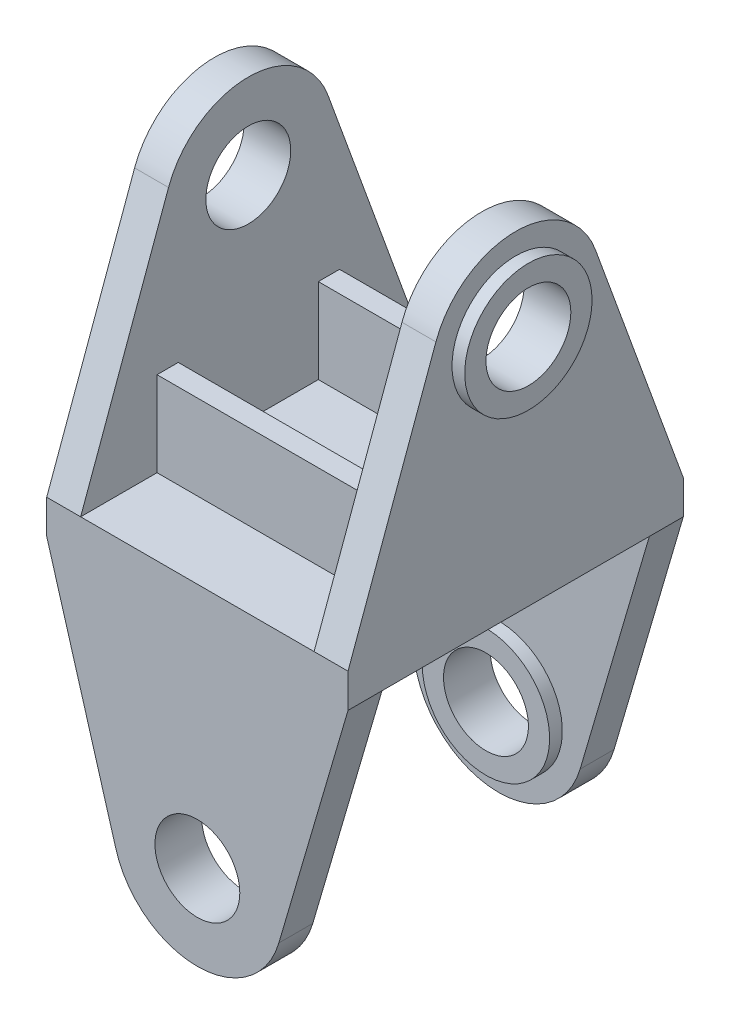
from build123d import *

# Parameters (mm, degrees)
SKETCH1_R                 = 15
BOSS_EXTRUDE1_DEPTH       = 8
BOSS_EXTRUDE2_START       = 3
SKETCH1_3_R               = 15
SKETCH1_3_R_2             = 10
BOSS_EXTRUDE2_DEPTH       = 11
BOSS_EXTRUDE3_START       = -63
SKETCH1_4_R               = 15
BOSS_EXTRUDE3_DEPTH       = 8
LPATTERN3_COUNT           = 2
LPATTERN3_PITCH           = 66
SKETCH3_R                 = 15
BOSS_EXTRUDE7_DEPTH       = 8
SKETCH3_7_R               = 15
SKETCH3_7_R_2             = 10
BOSS_EXTRUDE8_DEPTH       = 11
BOSS_EXTRUDE9_START       = -8
SKETCH4_R                 = 15
BOSS_EXTRUDE9_DEPTH       = 8
BOSS_EXTRUDE10_START      = -11
SKETCH4_4_R               = 15
SKETCH4_4_R_2             = 10
BOSS_EXTRUDE10_DEPTH      = 11
SKETCH5_W                 = 55
SKETCH5_H                 = 18
SKETCH5_H_2               = 33
BOSS_EXTRUDE11_DEPTH      = 8
BOSS_EXTRUDE13_DEPTH      = 20
BOSS_EXTRUDE13_DEPTH_BACK = 8
SKETCH5_3_W               = 55
SKETCH5_3_H               = 5


with BuildPart() as part:
    # Sketch1 → Boss-Extrude1 (new body)
    with BuildSketch(Plane(origin=(0, 0, 0), x_dir=(0, 0, -1), z_dir=(1, 0, 0))):
        with BuildLine():
            Line((-18.791946309, 6.845637584), (-39.5, -50))
            Line((-39.5, -50), (-39.5, -58))
            Line((-39.5, -58), (39.5, -58))
            Line((39.5, -58), (39.5, -50))
            Line((39.5, -50), (18.791946309, 6.845637584))
            ThreePointArc((18.791946309, 6.845637584), (0, 20), (-18.791946309, 6.845637584))
        make_face()
        Circle(SKETCH1_R, mode=Mode.SUBTRACT)
    extrude(amount=-BOSS_EXTRUDE1_DEPTH)

    # Sketch1<3> → Boss-Extrude2 (add)
    with BuildSketch(Plane(origin=(0, 0, 0), x_dir=(0, 0, -1), z_dir=(1, 0, 0)).offset(BOSS_EXTRUDE2_START)):
        Circle(SKETCH1_3_R)
        Circle(SKETCH1_3_R_2, mode=Mode.SUBTRACT)
    boss_extrude2 = extrude(amount=-BOSS_EXTRUDE2_DEPTH)



with BuildPart() as body_2:
    # Sketch1<4> → Boss-Extrude3 (new body)
    with BuildSketch(Plane(origin=(0, 0, 0), x_dir=(0, 0, -1), z_dir=(1, 0, 0)).offset(BOSS_EXTRUDE3_START)):
        with BuildLine():
            Line((-18.791946309, 6.845637584), (-39.5, -50))
            Line((-39.5, -50), (-39.5, -58))
            Line((-39.5, -58), (39.5, -58))
            Line((39.5, -58), (39.5, -50))
            Line((39.5, -50), (18.791946309, 6.845637584))
            ThreePointArc((18.791946309, 6.845637584), (0, 20), (-18.791946309, 6.845637584))
        make_face()
        Circle(SKETCH1_4_R, mode=Mode.SUBTRACT)
    extrude(amount=-BOSS_EXTRUDE3_DEPTH)

    # LPattern3: Boss-Extrude2 ×2
    with Locations(*[(-i * LPATTERN3_PITCH, 0, 0) for i in range(1, LPATTERN3_COUNT)]):
        add(boss_extrude2)


with BuildPart() as part_1:
    add(part.part)

    add(body_2.part)  # Boss-Extrude7 merges body 2
    # Sketch3 → Boss-Extrude7 (add)
    with BuildSketch(Plane.XY.offset(39.5)):
        with BuildLine():
            Line((-16.307748581, -113.626498508), (0, -58))
            Line((0, -58), (0, -50))
            Line((0, -50), (-71, -50))
            Line((-71, -50), (-71, -58))
            Line((-71, -58), (-54.692251419, -113.626498508))
            ThreePointArc((-54.692251419, -113.626498508), (-35.5, -128), (-16.307748581, -113.626498508))
        make_face()
        with Locations((-35.5, -108)):
            Circle(SKETCH3_R, mode=Mode.SUBTRACT)
    extrude(amount=-BOSS_EXTRUDE7_DEPTH)

    # Sketch3<7> → Boss-Extrude8 (add)
    with BuildSketch(Plane.XY.offset(39.5)):
        with Locations((-35.5, -108)):
            Circle(SKETCH3_7_R)
        with Locations((-35.5, -108)):
            Circle(SKETCH3_7_R_2, mode=Mode.SUBTRACT)
    extrude(amount=-BOSS_EXTRUDE8_DEPTH)

    # Sketch4 → Boss-Extrude9 (add)
    with BuildSketch(Plane(origin=(0, 0, -39.5), x_dir=(-1, 0, 0), z_dir=(0, 0, -1)).offset(BOSS_EXTRUDE9_START)):
        with BuildLine():
            Line((54.692251419, -113.626498508), (71, -58))
            Line((71, -58), (71, -50))
            Line((71, -50), (0, -50))
            Line((0, -50), (0, -58))
            Line((0, -58), (16.307748581, -113.626498508))
            ThreePointArc((16.307748581, -113.626498508), (35.5, -128), (54.692251419, -113.626498508))
        make_face()
        with Locations((35.5, -108)):
            Circle(SKETCH4_R, mode=Mode.SUBTRACT)
    extrude(amount=BOSS_EXTRUDE9_DEPTH)

    # Sketch4<4> → Boss-Extrude10 (add)
    with BuildSketch(Plane(origin=(0, 0, -39.5), x_dir=(-1, 0, 0), z_dir=(0, 0, -1)).offset(BOSS_EXTRUDE10_START)):
        with Locations((35.5, -108)):
            Circle(SKETCH4_4_R)
        with Locations((35.5, -108)):
            Circle(SKETCH4_4_R_2, mode=Mode.SUBTRACT)
    extrude(amount=BOSS_EXTRUDE10_DEPTH)

    # Sketch5 → Boss-Extrude11 (add)
    with BuildSketch(Plane(origin=(0, -50, 0), x_dir=(1, 0, 0), z_dir=(0, 1, 0))):
        with Locations((-35.5, 30.5)):
            Rectangle(SKETCH5_W, SKETCH5_H)
        with Locations((-35.5, 0)):
            Rectangle(SKETCH5_W, SKETCH5_H_2)
        with Locations((-35.5, -30.5)):
            Rectangle(SKETCH5_W, SKETCH5_H)
    extrude(amount=-BOSS_EXTRUDE11_DEPTH)

    # Sketch5<3> → Boss-Extrude13 (add, two sides: drawn at the far end of the back side and taken through both)
    with BuildSketch(Plane(origin=(0, -50, 0), x_dir=(1, 0, 0), z_dir=(0, 1, 0)).offset(-BOSS_EXTRUDE13_DEPTH_BACK)):
        with Locations((-35.5, 19)):
            Rectangle(SKETCH5_3_W, SKETCH5_3_H)
        with Locations((-35.5, -19)):
            Rectangle(SKETCH5_3_W, SKETCH5_3_H)
    extrude(amount=BOSS_EXTRUDE13_DEPTH + BOSS_EXTRUDE13_DEPTH_BACK)


solid = part_1.part
